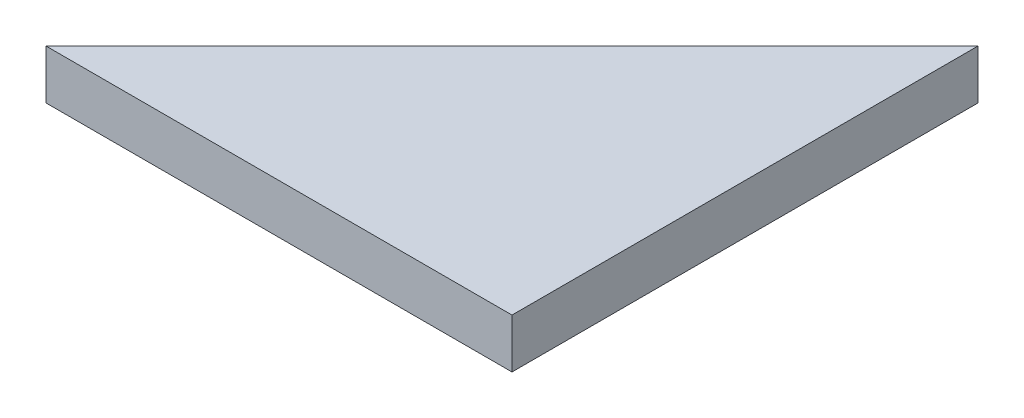
from build123d import *

# Parameters (mm, degrees)
BOSS_EXTRU_1_DEPTH = 6.35


with BuildPart() as part:
    # Esquisse1 → Boss.-Extru.1 (new body)
    with BuildSketch(Plane(origin=(0, 0, 0), x_dir=(1, 0, 0), z_dir=(0, 1, 0))):
        Polygon((0, 60), (-60, 0), (0, 0), align=None)
    extrude(amount=BOSS_EXTRU_1_DEPTH)


solid = part.part
